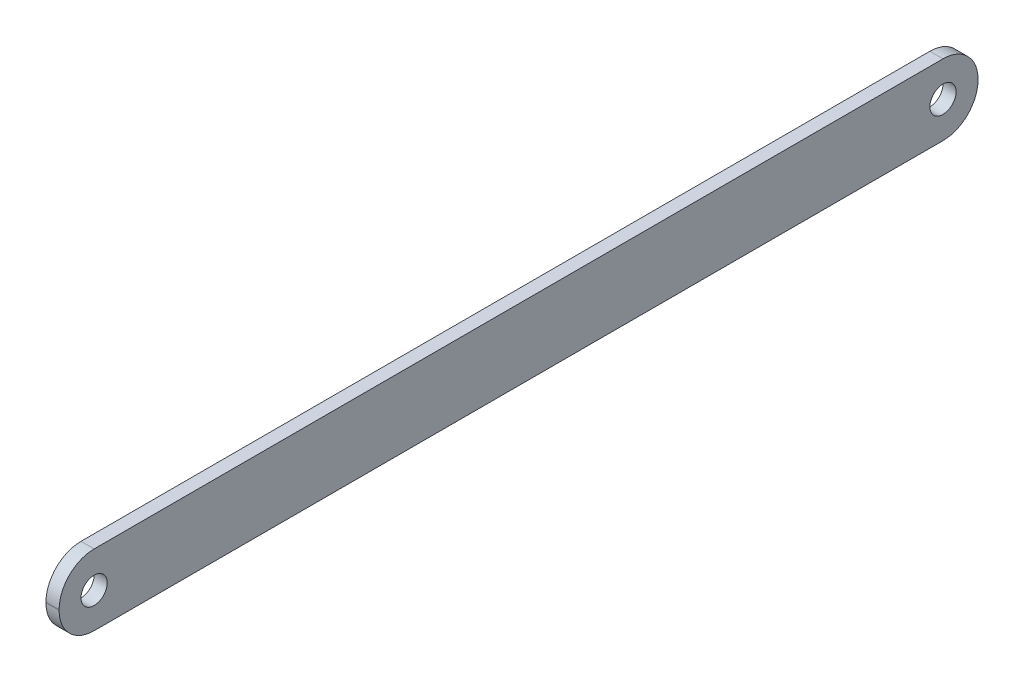
from build123d import *

# Parameters (mm, degrees)
SKETCH1_R           = 3
BOSS_EXTRUDE1_DEPTH = 3


with BuildPart() as part:
    # Sketch1 → Boss-Extrude1 (new body)
    with BuildSketch(Plane(origin=(0, 0, 0), x_dir=(0, 0, -1), z_dir=(1, 0, 0))):
        with BuildLine():
            Line((-97, 8.1), (97, 8.1))
            ThreePointArc((97, 8.1), (102.656854249, 5.756854249), (105, 0.1))
            Line((105, 0.1), (105, -0.1))
            ThreePointArc((105, -0.1), (102.656854249, -5.756854249), (97, -8.1))
            Line((97, -8.1), (-97, -8.1))
            ThreePointArc((-97, -8.1), (-102.656854249, -5.756854249), (-105, -0.1))
            Line((-105, -0.1), (-105, 0.1))
            ThreePointArc((-105, 0.1), (-102.656854249, 5.756854249), (-97, 8.1))
        make_face()
        with Locations((-97, -0.1)):
            Circle(SKETCH1_R, mode=Mode.SUBTRACT)
        with Locations((97, 0.1)):
            Circle(SKETCH1_R, mode=Mode.SUBTRACT)
    extrude(amount=BOSS_EXTRUDE1_DEPTH)


solid = part.part
